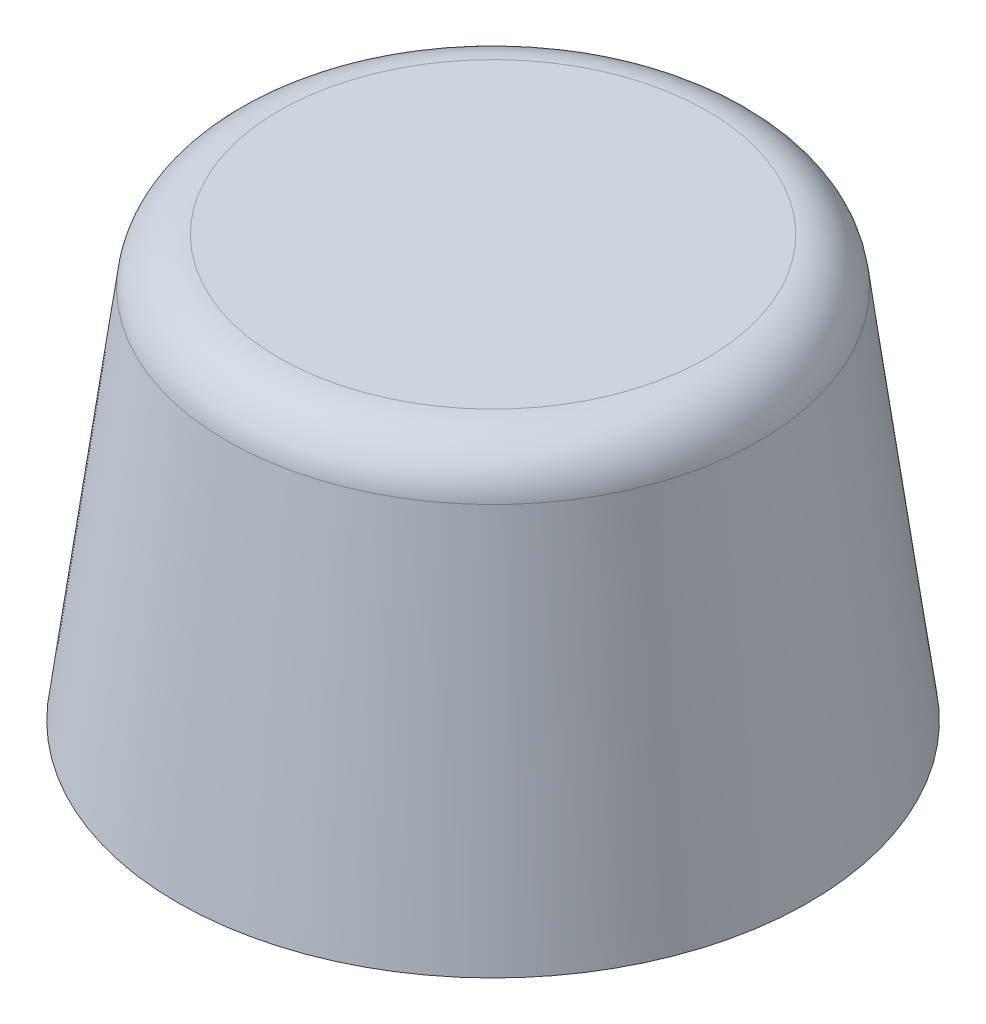
from build123d import *

# Parameters (mm, degrees)
SKETCH1_R           = 9.525
BOSS_EXTRUDE1_DEPTH = 12.7
BOSS_EXTRUDE1_TAPER = 7.5
CUT_EXTRUDE1_DEPTH  = 9.525
SKETCH3_R           = 3.175
CUT_EXTRUDE2_DEPTH  = 2.54
FILLET3_R           = 1.5875


with BuildPart() as part:
    # Sketch1 → Boss-Extrude1 (new body)
    with BuildSketch(Plane(origin=(0, 0, 0), x_dir=(1, 0, 0), z_dir=(0, 1, 0))):
        Circle(SKETCH1_R)
    extrude(amount=BOSS_EXTRUDE1_DEPTH, taper=BOSS_EXTRUDE1_TAPER)

    # Sketch2 → Cut-Extrude1 (cut)
    with BuildSketch(Plane.XZ):
        with BuildLine():
            Line((-2.851142929, -1.397), (2.851142929, -1.397))
            ThreePointArc((2.851142929, -1.397), (0, 3.175), (-2.851142929, -1.397))
        make_face()
    extrude(amount=-CUT_EXTRUDE1_DEPTH, mode=Mode.SUBTRACT)

    # Sketch3 → Cut-Extrude2 (cut)
    with BuildSketch(Plane.XZ):
        with Locations(Location((0, 0, 0), (0, 0, 270))):
            Circle(SKETCH3_R)
    extrude(amount=-CUT_EXTRUDE2_DEPTH, mode=Mode.SUBTRACT)

    # Fillet3
    fillet3_edges = [part.edges().sort_by_distance(p)[0] for p in [
        (-7.853013281, 12.7, 0),
    ]]
    fillet(fillet3_edges, radius=FILLET3_R)


solid = part.part
